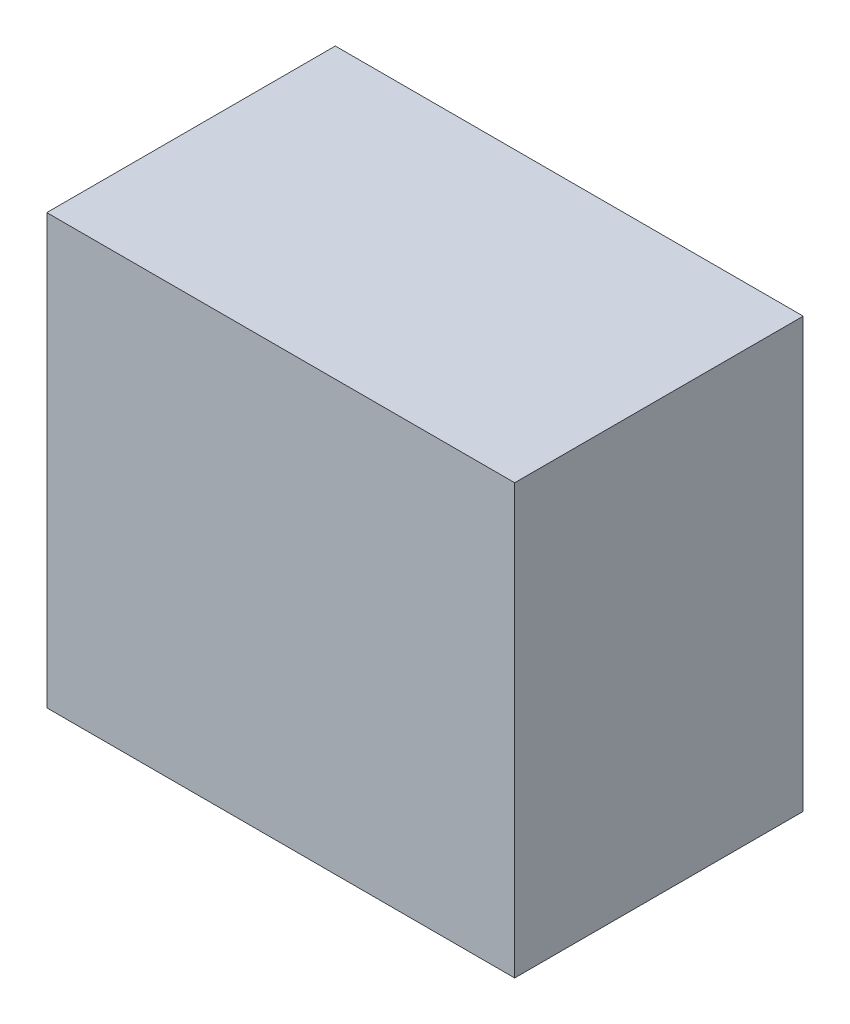
from build123d import *

# Parameters (mm, degrees)
CROQUIS1_W              = 600
CROQUIS1_H              = 550
SALIENTE_EXTRUIR1_DEPTH = 370


with BuildPart() as part:
    # Croquis1 → Saliente-Extruir1 (new body)
    with BuildSketch(Plane.XY):
        with Locations((300, 275)):
            Rectangle(CROQUIS1_W, CROQUIS1_H)
    extrude(amount=SALIENTE_EXTRUIR1_DEPTH)


solid = part.part
